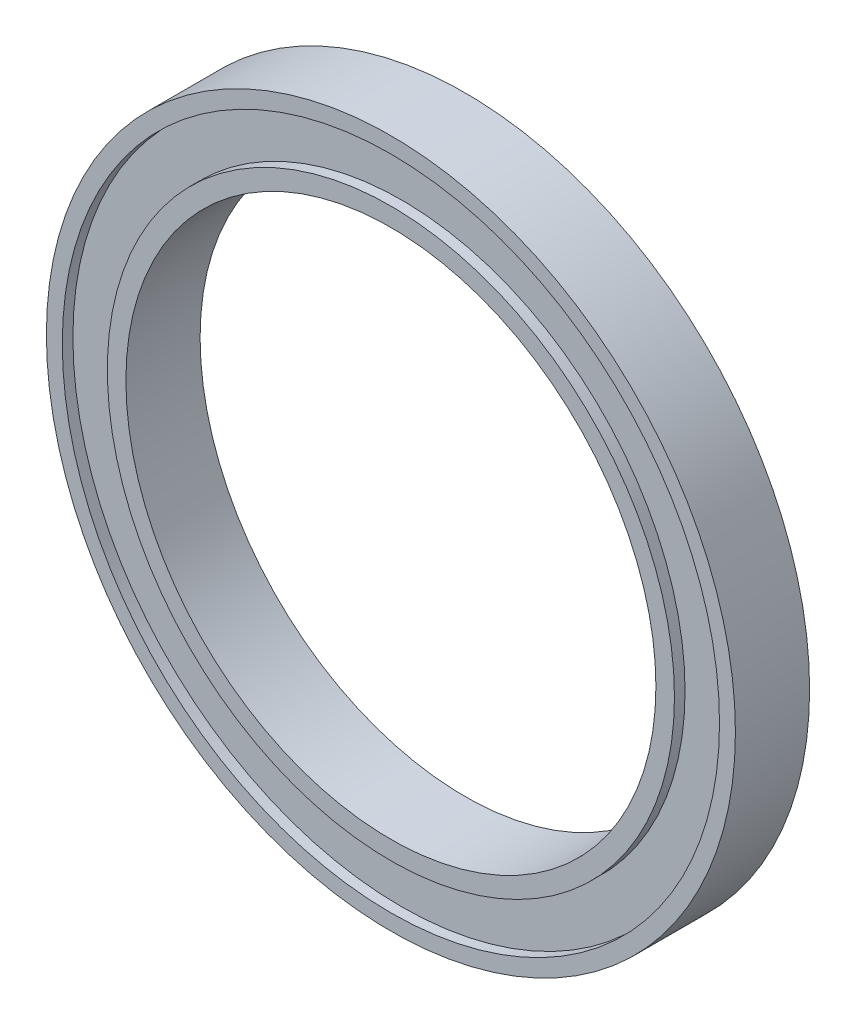
from build123d import *

# Parameters (mm, degrees)
SKETCH1_R           = 32.5
SKETCH1_R_2         = 25
BOSS_EXTRUDE1_DEPTH = 3.5
SKETCH2_R           = 31
SKETCH2_R_2         = 26.75
CUT_EXTRUDE1_DEPTH  = 1


with BuildPart() as part:
    # Sketch1 → Boss-Extrude1 (new, symmetric)
    with BuildSketch(Plane.XY):
        Circle(SKETCH1_R)
        Circle(SKETCH1_R_2, mode=Mode.SUBTRACT)
    extrude(amount=BOSS_EXTRUDE1_DEPTH, both=True)

    # Sketch2 → Cut-Extrude1 (cut)
    with BuildSketch(Plane.XY.offset(3.5)):
        Circle(SKETCH2_R)
        Circle(SKETCH2_R_2, mode=Mode.SUBTRACT)
    cut_extrude1 = extrude(amount=-CUT_EXTRUDE1_DEPTH, mode=Mode.SUBTRACT)

    # Mirror1: Cut-Extrude1 across plane
    add(cut_extrude1.mirror(Plane.XY), mode=Mode.SUBTRACT)


solid = part.part
